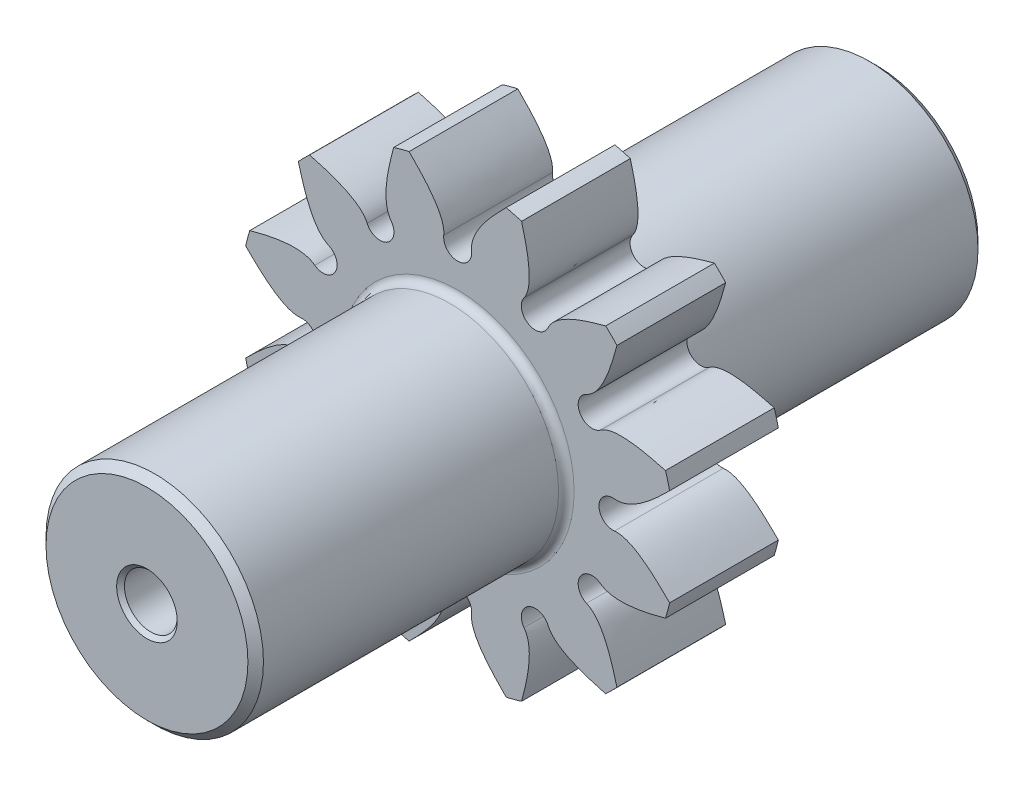
from build123d import *

# Parameters (mm, degrees)
ESQUISSE1_R                  = 14
BOSS_EXTRU_1_DEPTH           = 23.5
ESQUISSE2_R                  = 14
ESQUISSE2_R_2                = 7
ENL_V_MAT_EXTRU_1_DEPTH      = 20
CHANFREIN1_SIZE              = 0.5
CHANFREIN2_SIZE              = 0.25
ENL_V_MAT_EXTRU_2_DEPTH      = 34.481338086
R_P_TITION_CIRCULAIRE1_COUNT = 12
CONG_1_R                     = 0.5


with BuildPart() as part:
    # Esquisse1 → Boss.-Extru.1 (new, symmetric)
    with BuildSketch(Plane.XY):
        Circle(ESQUISSE1_R)
    extrude(amount=BOSS_EXTRU_1_DEPTH, both=True)

    # Esquisse2 → Enlèv. mat.-Extru.1 (cut)
    with BuildSketch(Plane.XY.offset(23.5)):
        Circle(ESQUISSE2_R)
        Circle(ESQUISSE2_R_2, mode=Mode.SUBTRACT)
    enl_v_mat_extru_1 = extrude(amount=-ENL_V_MAT_EXTRU_1_DEPTH, mode=Mode.SUBTRACT)

    # Symétrie1: Enlèv. mat.-Extru.1 across plane
    add(enl_v_mat_extru_1.mirror(Plane.XY), mode=Mode.SUBTRACT)

    # Chanfrein1
    chanfrein1_edges = [part.edges().sort_by_distance(p)[0] for p in [
        (-7, 0, -23.5),
        (-7, 0, 23.5),
    ]]
    chamfer(chanfrein1_edges, length=CHANFREIN1_SIZE)

    # Esquisse5 → Dégagement M31 (revolve, cut)
    with BuildSketch(Plane(origin=(0, 0, -23.5), x_dir=(0, 1, 0), z_dir=(1, 0, 0))):
        Polygon((0, 0), (0, 11.021463052), (1.7, 10), (1.7, 0), align=None)
    d_gagement_m31 = revolve(axis=Axis((0, 0, -29.85), (0, 0, 1)), mode=Mode.SUBTRACT)

    # Symétrie3: Dégagement M31 across plane
    add(d_gagement_m31.mirror(Plane.XY), mode=Mode.SUBTRACT)

    # Chanfrein2
    chanfrein2_edges = [part.edges().sort_by_distance(p)[0] for p in [
        (0, -1.7, -23.5),
        (0, -1.7, 23.5),
    ]]
    chamfer(chanfrein2_edges, length=CHANFREIN2_SIZE)

    # Esquisse6 → Enlèv. mat.-Extru.2 (cut, through all)
    with BuildSketch(Plane.XY.offset(3.5)):
        with BuildLine():
            ThreePointArc((-0.894427191, 10.1), (0, 9.1), (0.894427191, 10.1))
            add(Edge.make_bspline(
                [(3.125, 13.646771596), (2.565786021, 13.061320299), (0.752807094, 11.366688654), (0.894427191, 10.1)],
                knots=[0, 0, 0, 0, 1, 1, 1, 1], degree=3))
            ThreePointArc((3.125, 13.646771596), (0, 14), (-3.125, 13.646771596))
            add(Edge.make_bspline(
                [(-3.125, 13.646771596), (-2.565786021, 13.061320299), (-0.752807094, 11.366688654), (-0.894427191, 10.1)],
                knots=[0, 0, 0, 0, 1, 1, 1, 1], degree=3))
        make_face()
    enl_v_mat_extru_2 = extrude(amount=-ENL_V_MAT_EXTRU_2_DEPTH, mode=Mode.SUBTRACT)

    # Répétition circulaire1: Enlèv. mat.-Extru.2 ×12 about axis
    r_p_tition_circulaire1_axis = Axis((0, 0, 3.5), (0, 0, 1))
    for i in range(1, R_P_TITION_CIRCULAIRE1_COUNT):
        add(enl_v_mat_extru_2.rotate(r_p_tition_circulaire1_axis, i * 360 / R_P_TITION_CIRCULAIRE1_COUNT), mode=Mode.SUBTRACT)

    # Congé1
    cong_1_edges = [part.edges().sort_by_distance(p)[0] for p in [
        (-7, 0, -3.5),
        (-7, 0, 3.5),
    ]]
    fillet(cong_1_edges, radius=CONG_1_R)


solid = part.part
